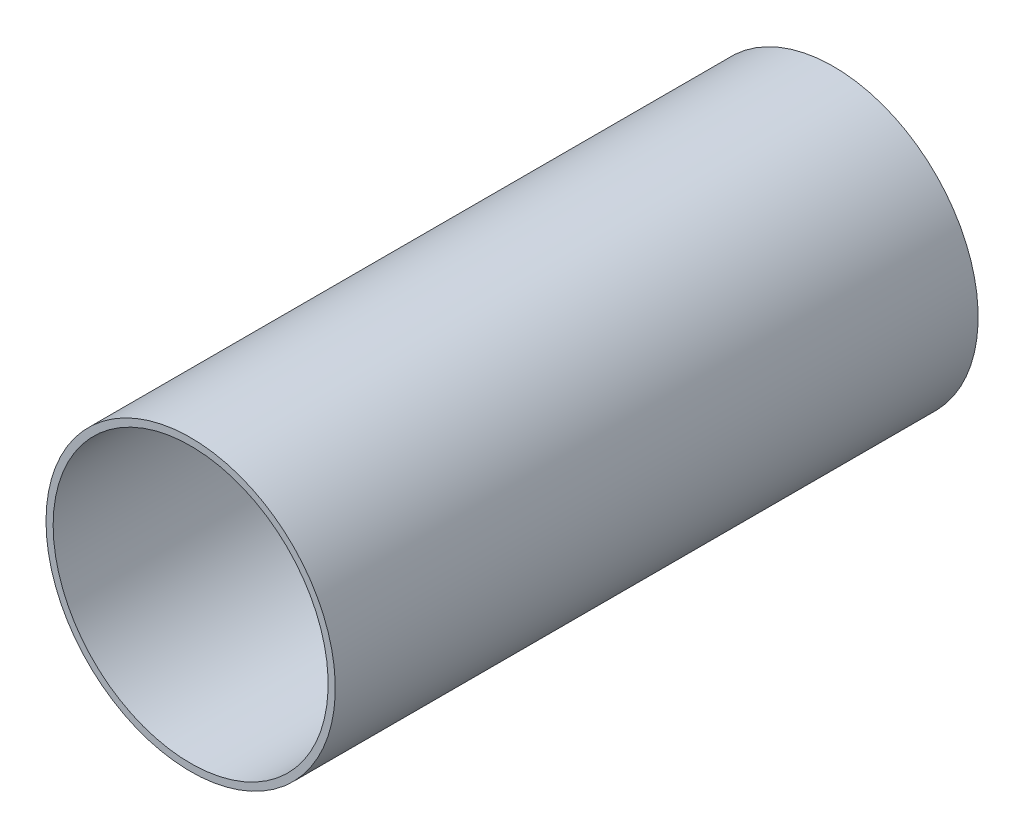
from build123d import *

# Parameters (mm, degrees)
SKETCH1_R           = 20.25
SKETCH1_R_2         = 19.25
BOSS_EXTRUDE1_DEPTH = 90


with BuildPart() as part:
    # Sketch1 → Boss-Extrude1 (new body)
    with BuildSketch(Plane.XY):
        with Locations(Location((0, 0, 0), (0, 0, 180))):
            Circle(SKETCH1_R)
        with Locations(Location((0, 0, 0), (0, 0, 180))):
            Circle(SKETCH1_R_2, mode=Mode.SUBTRACT)
    extrude(amount=BOSS_EXTRUDE1_DEPTH)


solid = part.part
